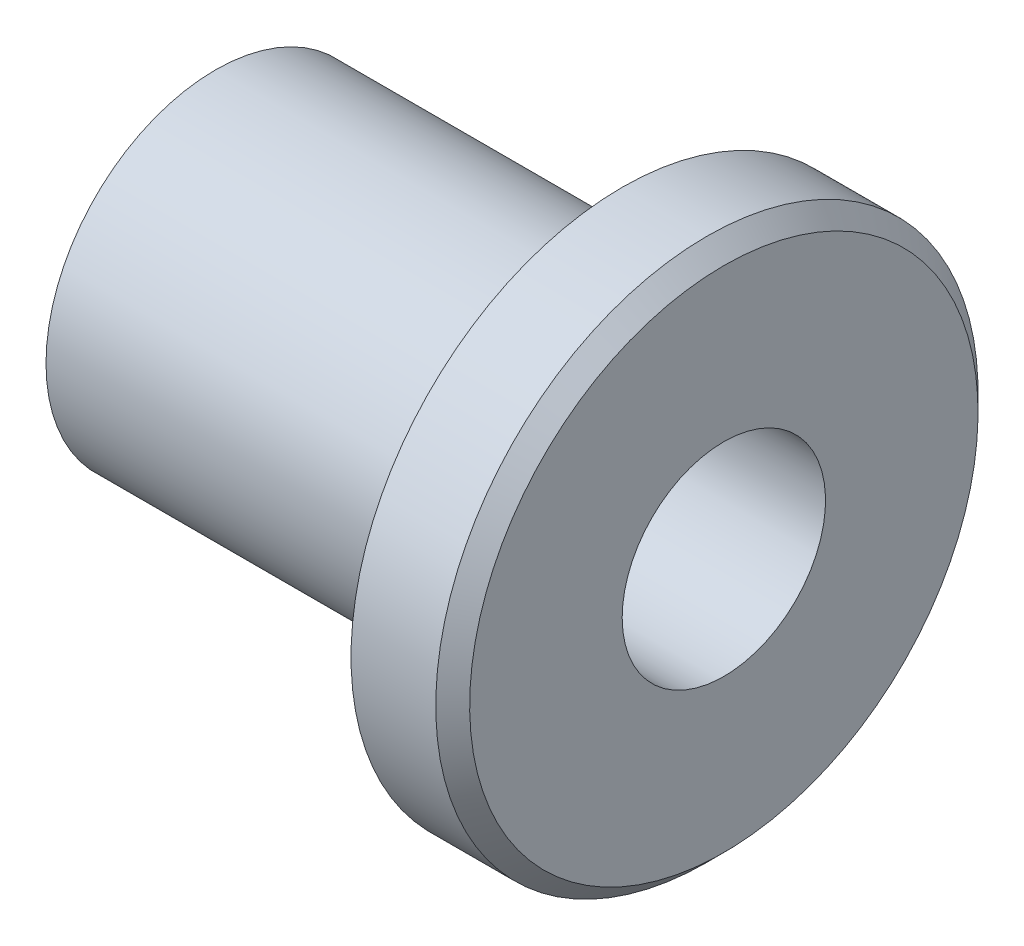
from build123d import *

# Parameters (mm, degrees)
HOLE_WIZARD_6_0_6_1_D     = 6
HOLE_WIZARD_6_0_6_1_DEPTH = 18.197418143
HOLE_WIZARD_6_0_6_1_TIP   = 1.802581857
CHAMFER_1_SIZE            = 0.5


with BuildPart() as part:
    # 草图1 → 旋转1 (revolve)
    with BuildSketch(Plane.XY):
        Polygon((-9.428571429, 0), (-9.428571429, 5), (2.571428571, 5), (2.571428571, 8), (5.571428571, 8), (5.571428571, 0), align=None)
    revolve(axis=Axis((5.571428571, 0, 0), (-1, 0, 0)))

    # Ø6.0 (6) 直径孔1
    with Locations(Plane.ZY.offset(9.428571429)):
        with Locations((0, 0)):
            Hole(HOLE_WIZARD_6_0_6_1_D / 2, depth=HOLE_WIZARD_6_0_6_1_DEPTH)
            with Locations((0, 0, -(HOLE_WIZARD_6_0_6_1_DEPTH + HOLE_WIZARD_6_0_6_1_TIP / 2))):  # 118° drill point
                Cone(0, HOLE_WIZARD_6_0_6_1_D / 2, HOLE_WIZARD_6_0_6_1_TIP, mode=Mode.SUBTRACT)

    # 倒角1
    chamfer_1_edges = [part.edges().sort_by_distance(p)[0] for p in [
        (5.571428571, -8, 0),
    ]]
    chamfer(chamfer_1_edges, length=CHAMFER_1_SIZE)


solid = part.part
